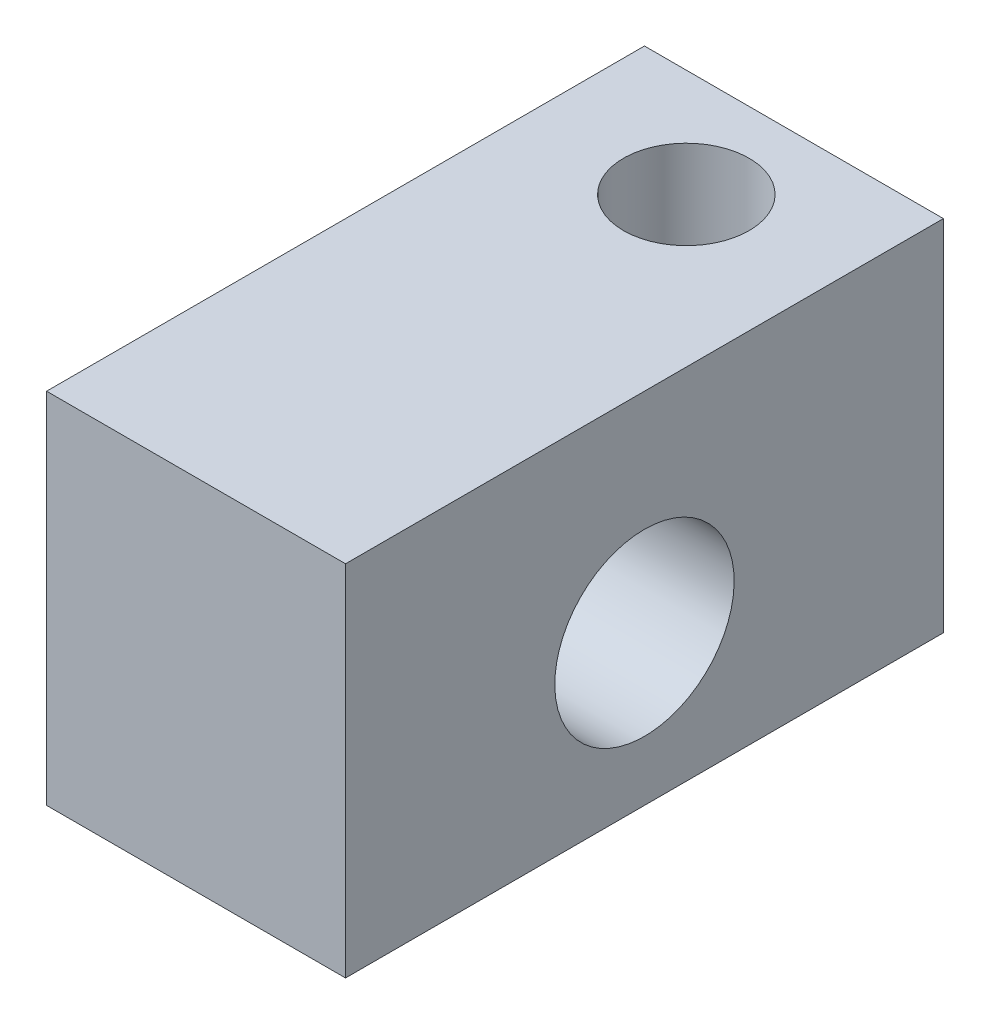
from build123d import *

# Parameters (mm, degrees)
SKETCH1_W           = 5
SKETCH1_H           = 6
BOSS_EXTRUDE1_DEPTH = 10
CUT_EXTRUDE1_REACH  = 14.689
SKETCH2_R           = 1.5
SKETCH3_R           = 1.05
CUT_EXTRUDE2_DEPTH  = 3.25
SKETCH4_R           = 1.05
CUT_EXTRUDE3_DEPTH  = 1.75


with BuildPart() as part:
    # Sketch1 → Boss-Extrude1 (new body)
    with BuildSketch(Plane.XY):
        with Locations((2.5, -3)):
            Rectangle(SKETCH1_W, SKETCH1_H)
    extrude(amount=BOSS_EXTRUDE1_DEPTH)

    # Sketch2 → Cut-Extrude1 (cut, up to next)
    with BuildSketch(Plane(origin=(5, 0, 0), x_dir=(0, 0, -1), z_dir=(1, 0, 0)), mode=Mode.PRIVATE) as cut_extrude1_sk1:
        with Locations(Location((-5, -3.5, 0), (0, 0, 90))):
            Circle(SKETCH2_R)
    cut_extrude1_tool1 = extrude(cut_extrude1_sk1.sketch, amount=-CUT_EXTRUDE1_REACH, mode=Mode.PRIVATE) & part.part
    add(cut_extrude1_tool1.solids().sort_by_distance((5, -3.5, 5))[0], mode=Mode.SUBTRACT)

    # Sketch3 → Cut-Extrude2 (cut)
    with BuildSketch(Plane(origin=(0, 0, 0), x_dir=(1, 0, 0), z_dir=(0, 1, 0))):
        with Locations(Location((2.5, -1.8, 0), (0, 0, 270))):
            Circle(SKETCH3_R)
    extrude(amount=-CUT_EXTRUDE2_DEPTH, mode=Mode.SUBTRACT)

    # Sketch4 → Cut-Extrude3 (cut)
    with BuildSketch(Plane.XZ.offset(6)):
        with Locations(Location((2.5, 8.2, 0), (0, 0, 270))):
            Circle(SKETCH4_R)
    extrude(amount=-CUT_EXTRUDE3_DEPTH, mode=Mode.SUBTRACT)


solid = part.part
